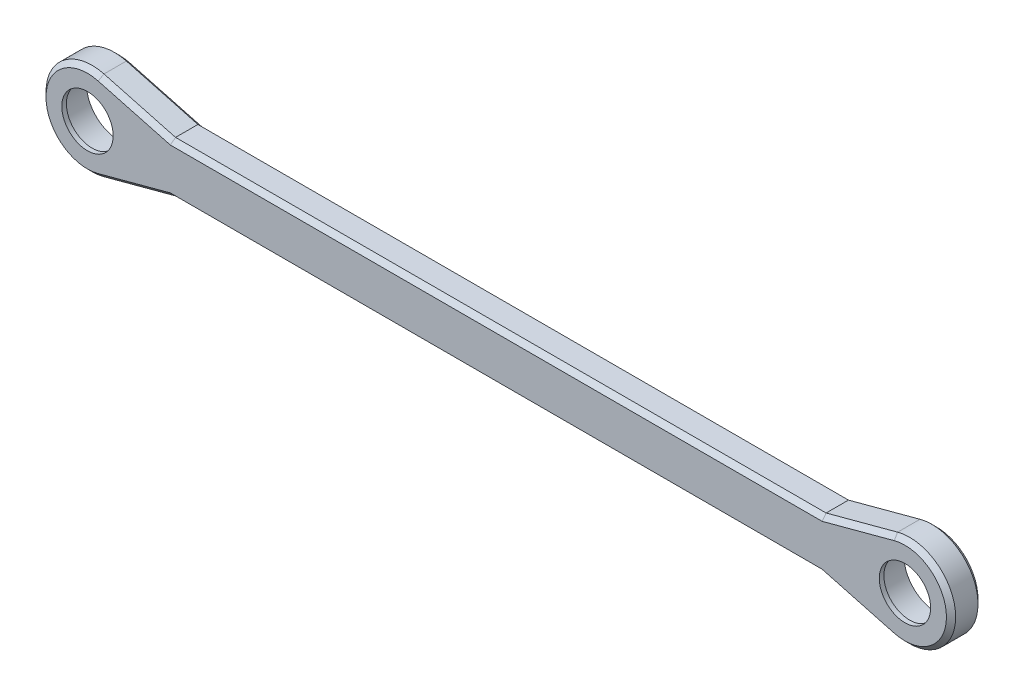
from build123d import *

# Parameters (mm, degrees)
SKETCH_1_R      = 7.075
EXTRUDE_1_DEPTH = 6.85
EXTRUDE_START   = -1
SKETCH_2_R      = 7.075
SKETCH_2_R_2    = 5.575
EXTRUDE_2_DEPTH = 1
CHAMFER_1_SIZE  = 1


with BuildPart() as part:
    # 草图1 → 凸台-拉伸1 (new body)
    with BuildSketch(Plane.XY):
        with BuildLine():
            ThreePointArc((2.588190451, 9.659258263), (-10, 0), (2.588190451, -9.659258263))
            Line((2.588190451, -9.659258263), (18.11075361, -5.5))
            Line((18.11075361, -5.5), (159.28924639, -5.5))
            Line((159.28924639, -5.5), (174.811809549, -9.659258263))
            ThreePointArc((174.811809549, -9.659258263), (187.4, 0), (174.811809549, 9.659258263))
            Line((174.811809549, 9.659258263), (159.28924639, 5.5))
            Line((159.28924639, 5.5), (18.11075361, 5.5))
            Line((18.11075361, 5.5), (2.588190451, 9.659258263))
        make_face()
        with Locations(Location((0, 0, 0), (0, 0, 180))):
            Circle(SKETCH_1_R, mode=Mode.SUBTRACT)
        with Locations(Location((177.4, 0, 0), (0, 0, 180))):
            Circle(SKETCH_1_R, mode=Mode.SUBTRACT)
    extrude(amount=EXTRUDE_1_DEPTH)

    # 草图2 → 凸台-拉伸2 (add)
    # profile 1 of 2: a face of its own
    with BuildSketch(Plane.XY.offset(6.85).offset(EXTRUDE_START)):
        with Locations(Location((0, 0, 0), (0, 0, 180))):
            Circle(SKETCH_2_R)
        Circle(SKETCH_2_R_2, mode=Mode.SUBTRACT)
    # profile 2 of 2: a face of its own
    with BuildSketch(Plane.XY.offset(6.85).offset(EXTRUDE_START)):
        with Locations(Location((177.4, 0, 0), (0, 0, 180))):
            Circle(SKETCH_2_R)
        with Locations((177.4, 0)):
            Circle(SKETCH_2_R_2, mode=Mode.SUBTRACT)
    extrude(amount=EXTRUDE_2_DEPTH)

    # 倒角1
    chamfer_1_edges = [part.edges().sort_by_distance(p)[0] for p in [
        (187.4, 0, 6.85),
        (88.7, -5.5, 0),
        (10.34947203, -7.579629131, 0),
        (-10, 0, 0),
        (10.34947203, 7.579629131, 0),
        (88.7, 5.5, 0),
        (167.05052797, 7.579629131, 0),
        (187.4, 0, 0),
        (167.05052797, -7.579629131, 0),
        (167.05052797, 7.579629131, 6.85),
        (88.7, 5.5, 6.85),
        (10.34947203, 7.579629131, 6.85),
        (-10, 0, 6.85),
        (10.34947203, -7.579629131, 6.85),
        (88.7, -5.5, 6.85),
        (167.05052797, -7.579629131, 6.85),
    ]]
    chamfer(chamfer_1_edges, length=CHAMFER_1_SIZE)


solid = part.part
